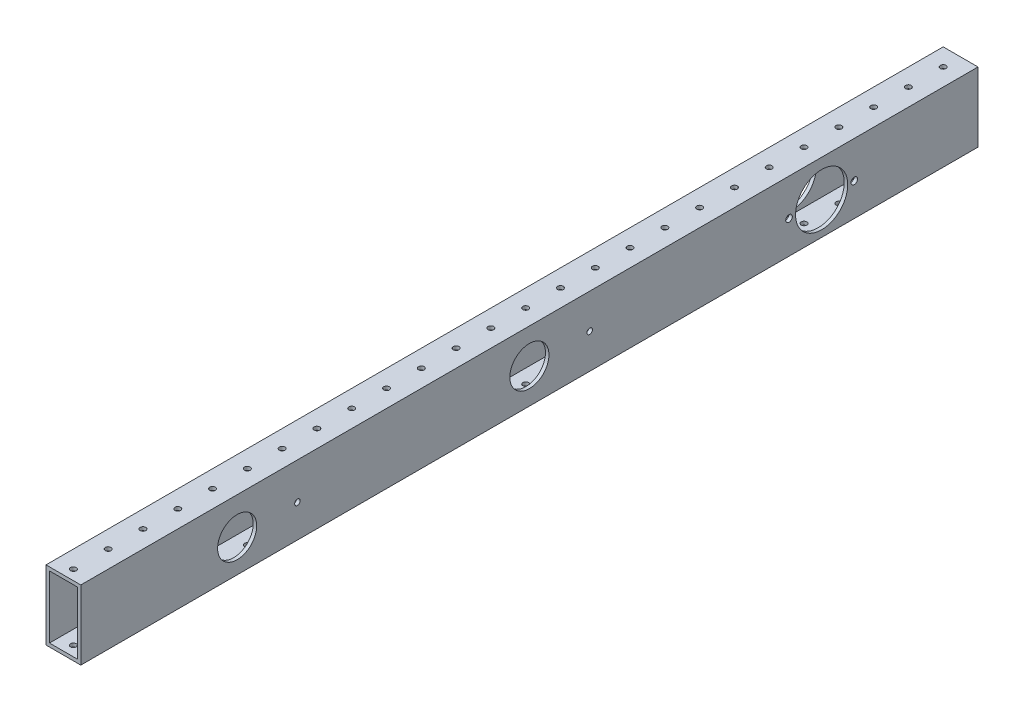
from build123d import *

# Parameters (mm, degrees)
CROQUIS1_W              = 25.4
CROQUIS1_H              = 50.7
CROQUIS1_W_2            = 20.32
CROQUIS1_H_2            = 45.62
SALIENTE_EXTRUIR1_DEPTH = 655
CROQUIS2_R              = 2.07
CORTAR_EXTRUIR1_DEPTH   = 658.082019234
CROQUIS3_R              = 14.275
CORTAR_EXTRUIR2_DEPTH   = 700
CROQUIS8_R              = 19.05
CROQUIS8_R_2            = 14.2748
CORTAR_EXTRUIR5_DEPTH   = 700
CROQUIS10_R             = 2.02
CORTAR_EXTRUIR7_DEPTH   = 656.982303496
CROQUIS12_R             = 2.02
CORTAR_EXTRUIR8_DEPTH   = 656.982303496
CROQUIS15_R             = 2.409528967
CROQUIS15_R_2           = 2.413
CORTAR_EXTRUIR10_DEPTH  = 656.982303496


with BuildPart() as part:
    # Croquis1 → Saliente-Extruir1 (new body)
    with BuildSketch(Plane.XY):
        Rectangle(CROQUIS1_W, CROQUIS1_H)
        Rectangle(CROQUIS1_W_2, CROQUIS1_H_2, mode=Mode.SUBTRACT)
    extrude(amount=SALIENTE_EXTRUIR1_DEPTH)

    # Croquis2 → Cortar-Extruir1 (cut, through all)
    with BuildSketch(Plane(origin=(0, 25.35, 0), x_dir=(1, 0, 0), z_dir=(0, 1, 0))):
        with Locations(Location((0, -12.7, 0), (0, 0, 270))):
            Circle(CROQUIS2_R)
        with Locations(Location((0, -38.1, 0), (0, 0, 270))):
            Circle(CROQUIS2_R)
        with Locations(Location((0, -63.5, 0), (0, 0, 270))):
            Circle(CROQUIS2_R)
        with Locations(Location((0, -88.9, 0), (0, 0, 270))):
            Circle(CROQUIS2_R)
        with Locations(Location((0, -114.3, 0), (0, 0, 270))):
            Circle(CROQUIS2_R)
        with Locations(Location((0, -139.7, 0), (0, 0, 270))):
            Circle(CROQUIS2_R)
        with Locations(Location((0, -165.1, 0), (0, 0, 270))):
            Circle(CROQUIS2_R)
        with Locations(Location((0, -190.5, 0), (0, 0, 270))):
            Circle(CROQUIS2_R)
        with Locations(Location((0, -215.9, 0), (0, 0, 270))):
            Circle(CROQUIS2_R)
        with Locations(Location((0, -241.3, 0), (0, 0, 270))):
            Circle(CROQUIS2_R)
        with Locations(Location((0, -266.7, 0), (0, 0, 270))):
            Circle(CROQUIS2_R)
        with Locations(Location((0, -292.1, 0), (0, 0, 270))):
            Circle(CROQUIS2_R)
        with Locations(Location((0, -317.5, 0), (0, 0, 270))):
            Circle(CROQUIS2_R)
        with Locations(Location((0, -342.9, 0), (0, 0, 270))):
            Circle(CROQUIS2_R)
        with Locations(Location((0, -368.3, 0), (0, 0, 270))):
            Circle(CROQUIS2_R)
        with Locations(Location((0, -393.7, 0), (0, 0, 270))):
            Circle(CROQUIS2_R)
        with Locations(Location((0, -419.1, 0), (0, 0, 270))):
            Circle(CROQUIS2_R)
        with Locations(Location((0, -444.5, 0), (0, 0, 270))):
            Circle(CROQUIS2_R)
        with Locations(Location((0, -469.9, 0), (0, 0, 270))):
            Circle(CROQUIS2_R)
        with Locations(Location((0, -495.3, 0), (0, 0, 270))):
            Circle(CROQUIS2_R)
        with Locations(Location((0, -520.7, 0), (0, 0, 270))):
            Circle(CROQUIS2_R)
        with Locations(Location((0, -546.1, 0), (0, 0, 270))):
            Circle(CROQUIS2_R)
        with Locations(Location((0, -571.5, 0), (0, 0, 270))):
            Circle(CROQUIS2_R)
        with Locations(Location((0, -596.9, 0), (0, 0, 270))):
            Circle(CROQUIS2_R)
        with Locations(Location((0, -622.3, 0), (0, 0, 270))):
            Circle(CROQUIS2_R)
        with Locations(Location((0, -647.7, 0), (0, 0, 270))):
            Circle(CROQUIS2_R)
    extrude(amount=-CORTAR_EXTRUIR1_DEPTH, mode=Mode.SUBTRACT)

    # Croquis3 → Cortar-Extruir2 (cut)
    with BuildSketch(Plane.ZY.offset(12.7)):
        with Locations(Location((327.5, 0, 0), (0, 0, 270))):
            Circle(CROQUIS3_R)
    extrude(amount=-CORTAR_EXTRUIR2_DEPTH, mode=Mode.SUBTRACT)

    # Croquis8 → Cortar-Extruir5 (cut)
    with BuildSketch(Plane.ZY.offset(12.7)):
        with Locations(Location((114.145124111, -1.474, 0), (0, 0, 270))):
            Circle(CROQUIS8_R)
        with Locations(Location((540.854875889, -1.474, 0), (0, 0, 270))):
            Circle(CROQUIS8_R_2)
    extrude(amount=-CORTAR_EXTRUIR5_DEPTH, mode=Mode.SUBTRACT)

    # Croquis10 → Cortar-Extruir7 (cut, through all)
    with BuildSketch(Plane(origin=(12.7, 0, 0), x_dir=(0, 0, -1), z_dir=(1, 0, 0))):
        with Locations(Location((-496.854875889, -1.45, 0), (0, 0, 90))):
            Circle(CROQUIS10_R)
    extrude(amount=-CORTAR_EXTRUIR7_DEPTH, mode=Mode.SUBTRACT)

    # Croquis12 → Cortar-Extruir8 (cut, through all)
    with BuildSketch(Plane(origin=(12.7, 0, 0), x_dir=(0, 0, -1), z_dir=(1, 0, 0))):
        with Locations(Location((-283.5, 0, 0), (0, 0, 90))):
            Circle(CROQUIS12_R)
    extrude(amount=-CORTAR_EXTRUIR8_DEPTH, mode=Mode.SUBTRACT)

    # Croquis15 → Cortar-Extruir10 (cut, through all)
    with BuildSketch(Plane.ZY.offset(12.7)):
        with Locations(Location((137.957624111, -1.474, 0), (0, 0, 270))):
            Circle(CROQUIS15_R)
        with Locations(Location((90.332624111, -1.474, 0), (0, 0, 270))):
            Circle(CROQUIS15_R_2)
    extrude(amount=-CORTAR_EXTRUIR10_DEPTH, mode=Mode.SUBTRACT)


solid = part.part
